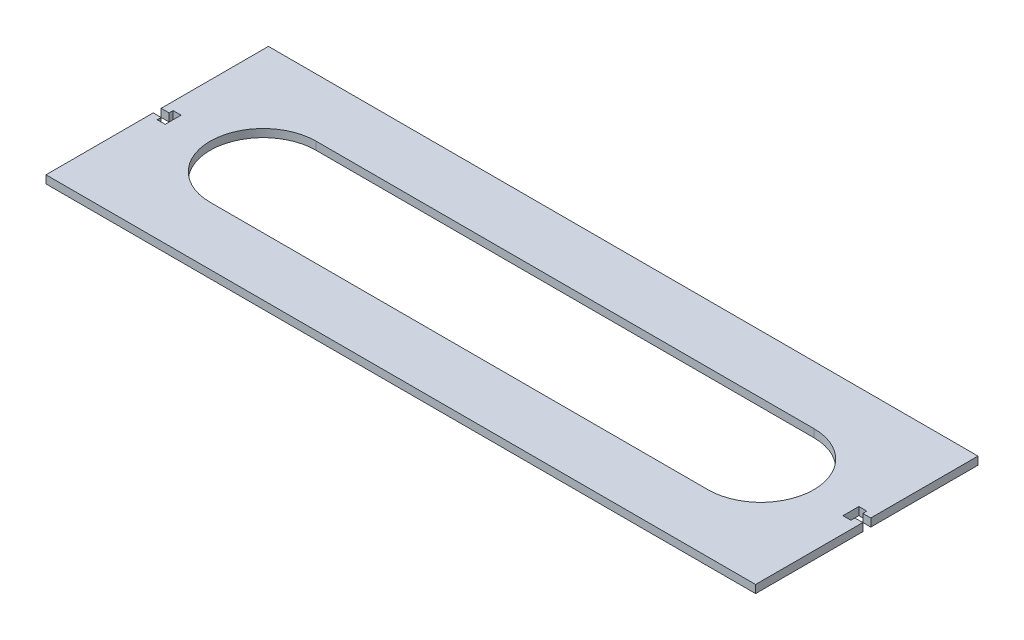
from build123d import *

# Parameters (mm, degrees)
SALIENTE_EXTRUIR2_DEPTH = 3


with BuildPart() as part:
    # Croquis1 → Saliente-Extruir2 (new body)
    with BuildSketch(Plane(origin=(0, 0, 0), x_dir=(1, 0, 0), z_dir=(0, 1, 0))):
        Polygon((134, -42), (-134, -42), (-134, -1.5), (-131, -1.5), (-131, -3), (-128, -3), (-128, 3), (-131, 3), (-131, 1.5), (-134, 1.5), (-134, 42), (134, 42), (134, 1.5), (131, 1.5), (131, 3), (128, 3), (128, -3), (131, -3), (131, -1.5), (134, -1.5), align=None)
        with BuildLine():
            Line((94, -20), (-94, -20))
            ThreePointArc((-94, -20), (-114, 0), (-94, 20))
            Line((-94, 20), (94, 20))
            ThreePointArc((94, 20), (114, 0), (94, -20))
        make_face(mode=Mode.SUBTRACT)
    extrude(amount=SALIENTE_EXTRUIR2_DEPTH)


solid = part.part
